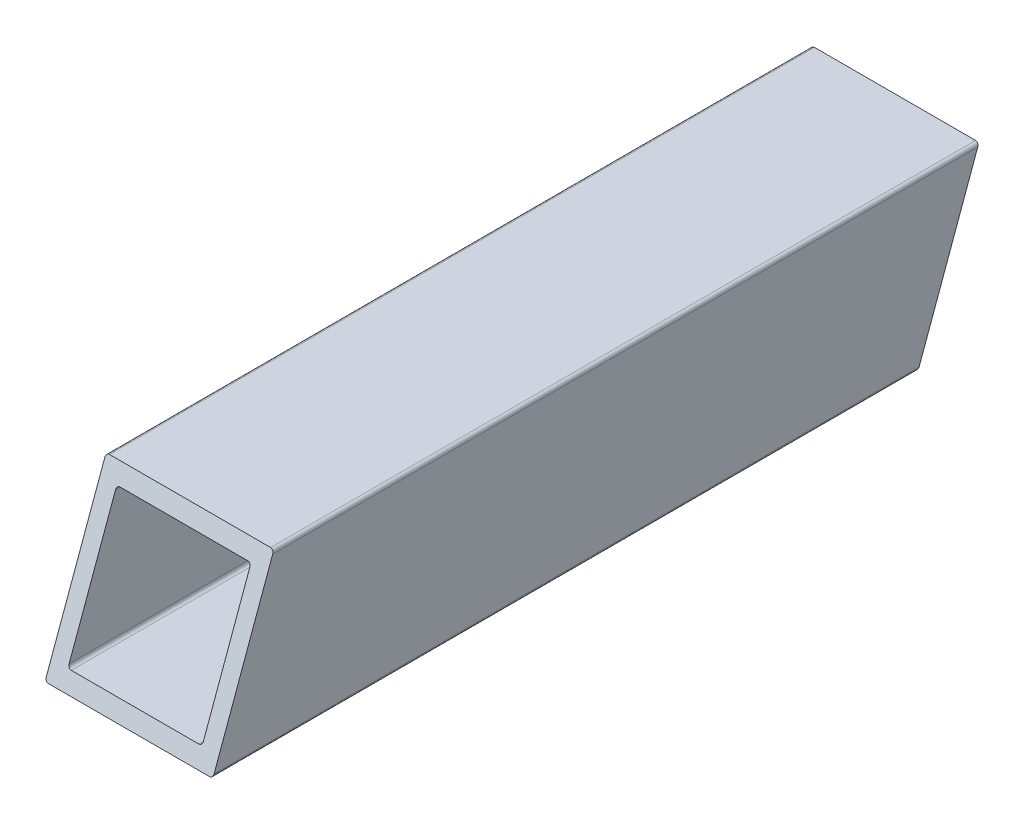
from build123d import *

# Parameters (mm, degrees)
SKETCH_1_W          = 10
SKETCH_1_H          = 10
SKETCH_1_W_2        = 8
SKETCH_1_H_2        = 8
EXTRUDE_1_DEPTH     = 200
FILLET_1_R          = 0.2
CUT_EXTRUDE_1_DEPTH = 201.31225624
CUT_EXTRUDE_2_DEPTH = 201.31225624


with BuildPart() as part:
    # 草圖1 → 填料-伸長1 (new body)
    with BuildSketch(Plane.XY):
        Rectangle(SKETCH_1_W, SKETCH_1_H)
        Rectangle(SKETCH_1_W_2, SKETCH_1_H_2, mode=Mode.SUBTRACT)
    extrude(amount=EXTRUDE_1_DEPTH)

    # 圓角1
    fillet_1_edges = [part.edges().sort_by_distance(p)[0] for p in [
        (-4, 4, 100),
        (-4, -4, 100),
        (4, -4, 100),
        (4, 4, 100),
        (-5, 5, 100),
        (5, 5, 100),
        (5, -5, 100),
        (-5, -5, 100),
    ]]
    fillet(fillet_1_edges, radius=FILLET_1_R)

    # 草圖2 → 除料-伸長1 (cut, through all)
    with BuildSketch(Plane(origin=(5, 0, 0), x_dir=(0, 0, -1), z_dir=(1, 0, 0))):
        Polygon((0, 5), (0, -5), (-3.639702343, -5), align=None)
    extrude(amount=-CUT_EXTRUDE_1_DEPTH, mode=Mode.SUBTRACT)

    # 草圖3 → 除料-伸長2 (cut, through all)
    with BuildSketch(Plane(origin=(5, 0, 0), x_dir=(0, 0, -1), z_dir=(1, 0, 0))):
        Polygon((-45.639702343, -5), (-42, 5), (-200, 5), (-200, -5), align=None)
    extrude(amount=-CUT_EXTRUDE_2_DEPTH, mode=Mode.SUBTRACT)


solid = part.part
